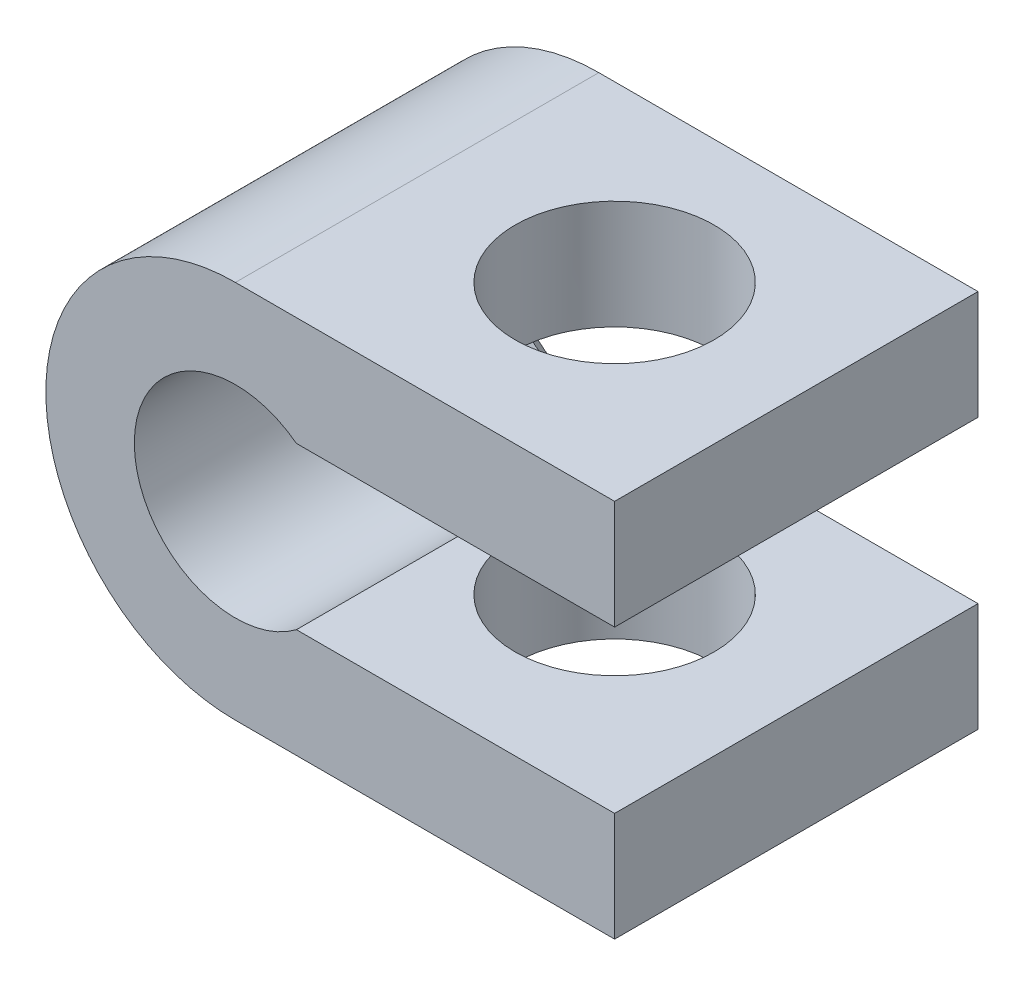
from build123d import *

# Parameters (mm, degrees)
BOSS_EXTRUDE1_DEPTH     = 12
CUT_EXTRUDE1_DEPTH      = 19
CUT_EXTRUDE1_DEPTH_BACK = 19
SKETCH2_R               = 3.15
CHAMFER1_SIZE           = 0.5


with BuildPart() as part:
    # Sketch1 → Boss-Extrude1 (new body)
    with BuildSketch(Plane.XY):
        with BuildLine():
            Line((0, 6), (12, 6))
            Line((12, 6), (12, 2.552710574))
            Line((12, 2.552710574), (1.929680991, 2.552710574))
            ThreePointArc((1.929680991, 2.552710574), (-3.2, 0), (1.929680991, -2.552710574))
            Line((1.929680991, -2.552710574), (12, -2.552710574))
            Line((12, -2.552710574), (12, -6))
            Line((12, -6), (0, -6))
            ThreePointArc((0, -6), (-6, 0), (0, 6))
        make_face()
    extrude(amount=BOSS_EXTRUDE1_DEPTH)

    # Sketch2 → Cut-Extrude1 (cut, two sides: drawn at the far end of the back side and taken through both)
    with BuildSketch(Plane(origin=(0, 0, 0), x_dir=(1, 0, 0), z_dir=(0, 1, 0)).offset(-CUT_EXTRUDE1_DEPTH_BACK)):
        with Locations((6, -6)):
            Circle(SKETCH2_R)
    extrude(amount=CUT_EXTRUDE1_DEPTH + CUT_EXTRUDE1_DEPTH_BACK, mode=Mode.SUBTRACT)

    # Chamfer1
    chamfer1_edges = [part.edges().sort_by_distance(p)[0] for p in [
        (6.964840496, -2.552710574, 0),
        (-3.2, 0, 0),
        (6.964840496, 2.552710574, 0),
        (6, -6, 0),
        (12, -4.276355287, 0),
        (-6, 0, 0),
        (6, 6, 0),
        (12, 4.276355287, 0),
    ]]
    chamfer(chamfer1_edges, length=CHAMFER1_SIZE)


solid = part.part
